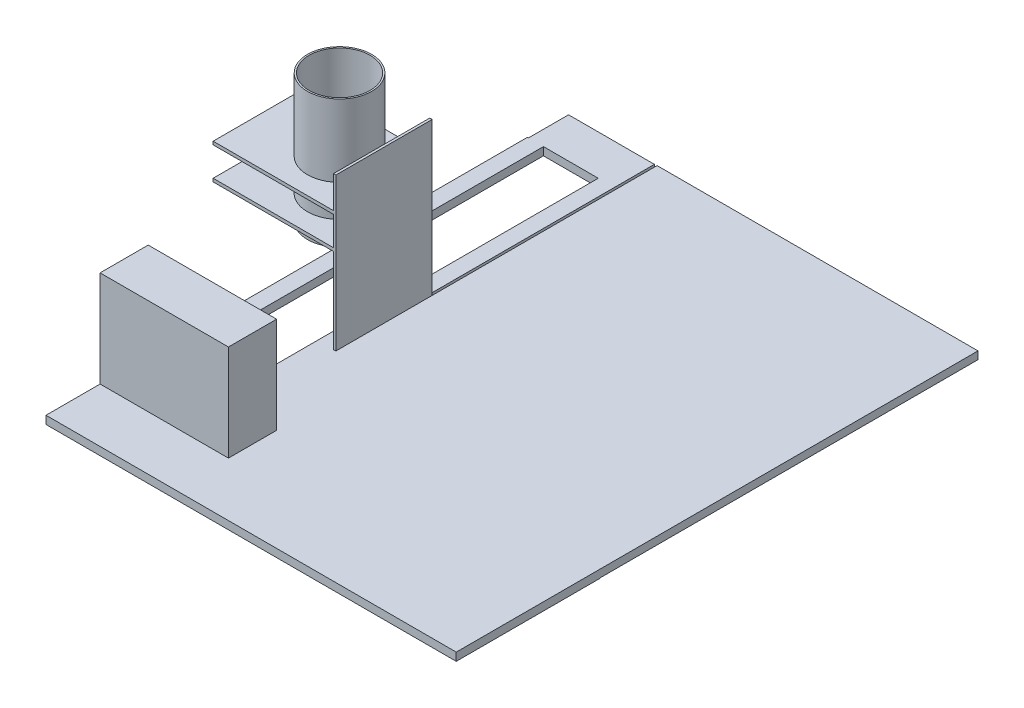
from build123d import *

# Parameters (mm, degrees)
SKETCH1_W                = 20
SKETCH1_H                = 350
BOSS_EXTRUDE1_DEPTH      = 10
BOSS_EXTRUDE1_2_DEPTH    = 10
BOSS_EXTRUDE2_DEPTH      = 0.001
BOSS_EXTRUDE2_DEPTH_BACK = 10
SKETCH2_W                = 107.015982705
SKETCH2_H                = 50
SKETCH3_W                = 120
SKETCH3_H                = 200
BOSS_EXTRUDE3_DEPTH      = 3
SKETCH4_W                = 120
SKETCH4_H                = 4
BOSS_EXTRUDE4_DEPTH      = 150
SKETCH5_R                = 40
CUT_EXTRUDE1_DEPTH       = 90
BOSS_EXTRUDE5_DEPTH      = 90
BOSS_EXTRUDE5_DEPTH_BACK = 70
SKETCH6_R                = 40
SKETCH7_R                = 38
CUT_EXTRUDE2_DEPTH       = 176
SKETCH8_W                = 20
SKETCH8_H                = 10
SKETCH8_W_2              = 23
BOSS_EXTRUDE6_DEPTH      = 70
SKETCH9_W                = 470.324280976
SKETCH9_H                = 9.538817488
BOSS_EXTRUDE7_DEPTH      = 400
SKETCH10_W               = 511.33
SKETCH10_H               = 10
BOSS_EXTRUDE8_DEPTH      = 180
SKETCH11_W               = 160
SKETCH11_H               = 60
BOSS_EXTRUDE9_DEPTH      = 120


with BuildPart() as part:
    # Sketch1 → Boss-Extrude1 (new body)
    with BuildSketch(Plane(origin=(0, 0, 0), x_dir=(1, 0, 0), z_dir=(0, 1, 0))):
        with Locations((-51.819592314, 74.671278777)):
            Rectangle(SKETCH1_W, SKETCH1_H)
    extrude(amount=BOSS_EXTRUDE1_DEPTH)



with BuildPart() as body_2:
    # Sketch1 → Boss-Extrude1 2 (new body)
    with BuildSketch(Plane(origin=(0, 0, 0), x_dir=(1, 0, 0), z_dir=(0, 1, 0))):
        with Locations((36.510407686, 74.671278777)):
            Rectangle(SKETCH1_W, SKETCH1_H)
    extrude(amount=BOSS_EXTRUDE1_2_DEPTH)


with BuildPart() as part_1:
    add(part.part)

    add(body_2.part)  # Boss-Extrude2 merges body 2
    # Sketch2 → Boss-Extrude2 (add, two sides: drawn at the far end of the back side and taken through both)
    with BuildSketch(Plane(origin=(0, 0, 0), x_dir=(-1, 0, 0), z_dir=(0, -1, 0)).offset(-BOSS_EXTRUDE2_DEPTH_BACK)):
        with Locations((6.997583667, 274.671278777)):
            Rectangle(SKETCH2_W, SKETCH2_H)
    extrude(amount=BOSS_EXTRUDE2_DEPTH + BOSS_EXTRUDE2_DEPTH_BACK)

    # Sketch3 → Boss-Extrude3 (add)
    with BuildSketch(Plane(origin=(46.510407686, 0, 0), x_dir=(0, 0, -1), z_dir=(1, 0, 0))):
        with Locations((-40.328721223, 100)):
            Rectangle(SKETCH3_W, SKETCH3_H)
    extrude(amount=BOSS_EXTRUDE3_DEPTH)

    # Sketch4 → Boss-Extrude4 (add)
    with BuildSketch(Plane.ZY.offset(-46.510407686)):
        with Locations((40.328721223, 158)):
            Rectangle(SKETCH4_W, SKETCH4_H)
        with Locations((40.328721223, 118)):
            Rectangle(SKETCH4_W, SKETCH4_H)
    extrude(amount=BOSS_EXTRUDE4_DEPTH)

    # Sketch5 → Cut-Extrude1 (cut)
    with BuildSketch(Plane(origin=(0, 160, 0), x_dir=(1, 0, 0), z_dir=(0, 1, 0))):
        with Locations(Location((-8.489592314, -37.781336818, 0), (0, 0, 270))):
            Circle(SKETCH5_R)
    extrude(amount=-CUT_EXTRUDE1_DEPTH, mode=Mode.SUBTRACT)

    # Sketch6 → Boss-Extrude5 (add, two sides: drawn at the far end of the back side and taken through both)
    with BuildSketch(Plane(origin=(0, 160, 0), x_dir=(1, 0, 0), z_dir=(0, 1, 0)).offset(-BOSS_EXTRUDE5_DEPTH_BACK)):
        with Locations(Location((-8.489592314, -37.781336818, 0), (0, 0, 270))):
            Circle(SKETCH6_R)
    extrude(amount=BOSS_EXTRUDE5_DEPTH + BOSS_EXTRUDE5_DEPTH_BACK)

    # Sketch7 → Cut-Extrude2 (cut)
    with BuildSketch(Plane(origin=(0, 250, 0), x_dir=(1, 0, 0), z_dir=(0, 1, 0))):
        with Locations(Location((-8.489592314, -37.781336818, 0), (0, 0, 270))):
            Circle(SKETCH7_R)
    extrude(amount=-CUT_EXTRUDE2_DEPTH, mode=Mode.SUBTRACT)

    # Sketch8 → Boss-Extrude6 (add)
    with BuildSketch(Plane.XY.offset(100.328721223)):
        with Locations((-51.819592314, 5)):
            Rectangle(SKETCH8_W, SKETCH8_H)
        with Locations((38.010407686, 5)):
            Rectangle(SKETCH8_W_2, SKETCH8_H)
    extrude(amount=BOSS_EXTRUDE6_DEPTH)

    # Sketch9 → Boss-Extrude7 (add)
    with BuildSketch(Plane(origin=(49.510407686, 0, 0), x_dir=(0, 0, -1), z_dir=(1, 0, 0))):
        with Locations((64.833419265, 5.230591256)):
            Rectangle(SKETCH9_W, SKETCH9_H)
    extrude(amount=BOSS_EXTRUDE7_DEPTH)

    # Sketch10 → Boss-Extrude8 (add)
    with BuildSketch(Plane.XY.offset(170.328721223)):
        with Locations((193.845407686, 5)):
            Rectangle(SKETCH10_W, SKETCH10_H)
    extrude(amount=BOSS_EXTRUDE8_DEPTH)

    # Sketch11 → Boss-Extrude9 (add)
    with BuildSketch(Plane(origin=(0, 10, 0), x_dir=(1, 0, 0), z_dir=(0, 1, 0))):
        with Locations((18.180407686, -252.921925031)):
            Rectangle(SKETCH11_W, SKETCH11_H)
    extrude(amount=BOSS_EXTRUDE9_DEPTH)


solid = part_1.part
